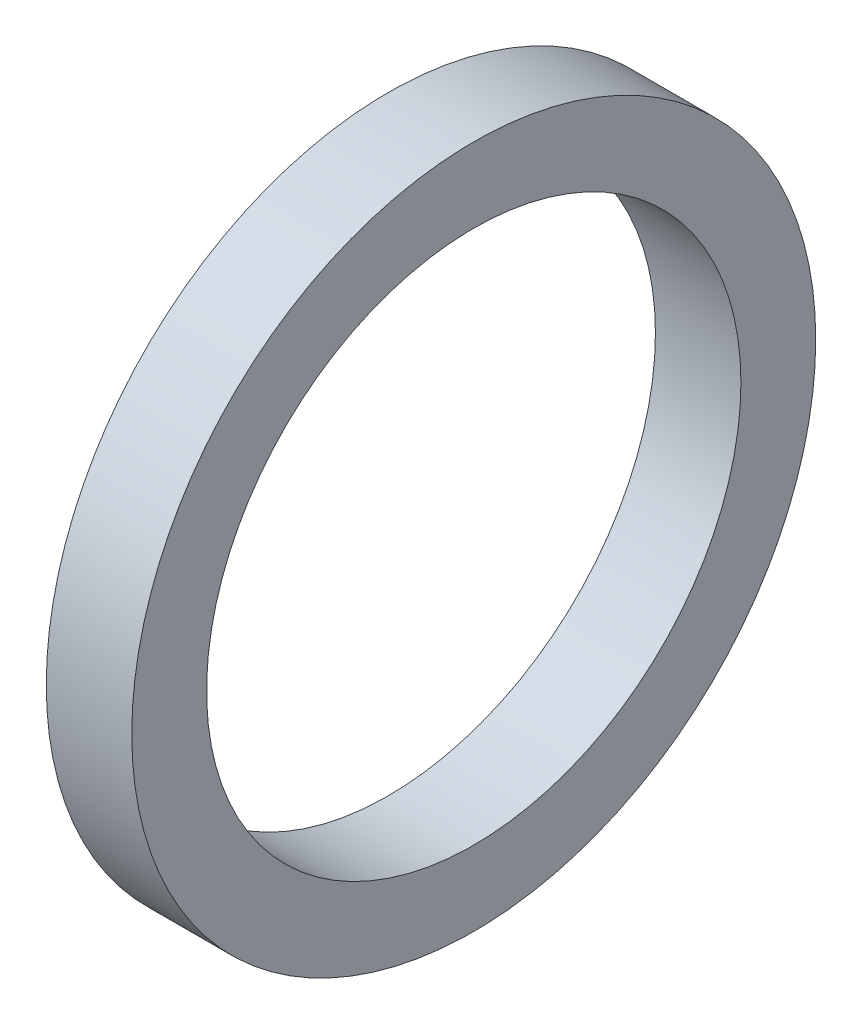
from build123d import *

# Parameters (mm, degrees)
SKETCH_1_R      = 16
SKETCH_1_R_2    = 12.5
EXTRUDE_1_DEPTH = 4


with BuildPart() as part:
    # 草图1 → 凸台-拉伸1 (new body)
    with BuildSketch(Plane(origin=(0, 0, 0), x_dir=(0, 0, -1), z_dir=(1, 0, 0))):
        Circle(SKETCH_1_R)
        Circle(SKETCH_1_R_2, mode=Mode.SUBTRACT)
    extrude(amount=EXTRUDE_1_DEPTH)


solid = part.part
